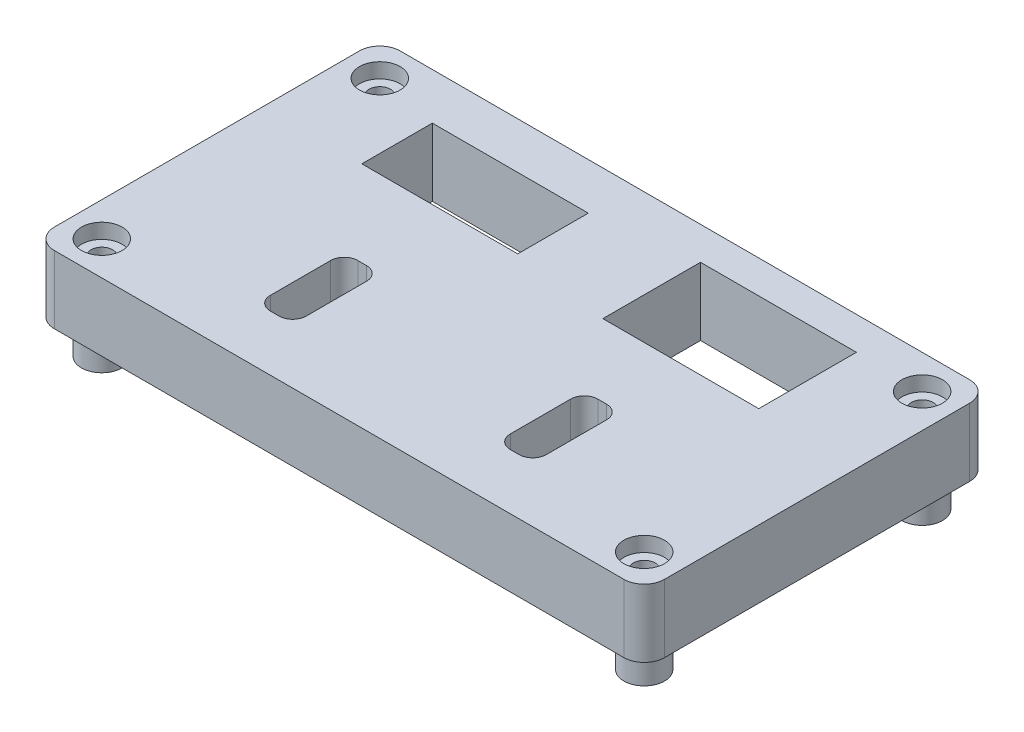
from build123d import *

# Parameters (mm, degrees)
SKETCH_1_W          = 90
SKETCH_1_H          = 51
SKETCH_1_R          = 1.6
SKETCH_1_W_2        = 23
SKETCH_1_H_2        = 10.4
SKETCH_1_H_3        = 14.4
SKETCH_1_W_3        = 5.3
SKETCH_1_H_4        = 12.9
EXTRUDE_1_DEPTH     = 10
FILLET_1_R          = 2
EXTRUDE_START       = 5
SKETCH_2_R          = 3
SKETCH_2_R_2        = 1.6
EXTRUDE_2_DEPTH     = 5
FILLET_2_R          = 3
CUT_EXTRUDE_START   = -2.2
SKETCH_3_R          = 3
CUT_EXTRUDE_1_DEPTH = 2.2


with BuildPart() as part:
    # ｽｹｯﾁ1 → ﾎﾞｽ - 押し出し1 (new body)
    with BuildSketch(Plane(origin=(0, 0, 0), x_dir=(1, 0, 0), z_dir=(0, 1, 0))):
        with Locations((45, 25.5)):
            Rectangle(SKETCH_1_W, SKETCH_1_H)
        with Locations(Location((5, 46, 0), (0, 0, 270))):
            Circle(SKETCH_1_R, mode=Mode.SUBTRACT)
        with Locations(Location((85, 46, 0), (0, 0, 90))):
            Circle(SKETCH_1_R, mode=Mode.SUBTRACT)
        with Locations(Location((85, 5, 0), (0, 0, 270))):
            Circle(SKETCH_1_R, mode=Mode.SUBTRACT)
        with Locations(Location((5, 5, 0), (0, 0, 90))):
            Circle(SKETCH_1_R, mode=Mode.SUBTRACT)
        with Locations((26.1, 38.95)):
            Rectangle(SKETCH_1_W_2, SKETCH_1_H_2, mode=Mode.SUBTRACT)
        with Locations((63.65, 38.95)):
            Rectangle(SKETCH_1_W_2, SKETCH_1_H_3, mode=Mode.SUBTRACT)
        with Locations((27.3, 14.65)):
            Rectangle(SKETCH_1_W_3, SKETCH_1_H_4, mode=Mode.SUBTRACT)
        with Locations((62.7, 14.65)):
            Rectangle(SKETCH_1_W_3, SKETCH_1_H_4, mode=Mode.SUBTRACT)
    extrude(amount=EXTRUDE_1_DEPTH)

    # ﾌｨﾚｯﾄ1
    fillet_1_edges = [part.edges().sort_by_distance(p)[0] for p in [
        (60.05, 5, -21.1),
        (60.05, 5, -8.2),
        (65.35, 5, -8.2),
        (65.35, 5, -21.1),
        (29.95, 5, -21.1),
        (24.65, 5, -21.1),
        (24.65, 5, -8.2),
        (29.95, 5, -8.2),
    ]]
    fillet(fillet_1_edges, radius=FILLET_1_R)

    # ｽｹｯﾁ2 → ﾎﾞｽ - 押し出し2 (add)
    # profile 1 of 4: a face of its own
    with BuildSketch(Plane.XZ.offset(EXTRUDE_START)):
        with Locations(Location((5, -5, 0), (0, 0, 270))):
            Circle(SKETCH_2_R)
        with Locations(Location((5, -5, 0), (0, 0, 270))):
            Circle(SKETCH_2_R_2, mode=Mode.SUBTRACT)
    # profile 2 of 4: a face of its own
    with BuildSketch(Plane.XZ.offset(EXTRUDE_START)):
        with Locations(Location((85, -5, 0), (0, 0, 90))):
            Circle(SKETCH_2_R)
        with Locations(Location((85, -5, 0), (0, 0, 90))):
            Circle(SKETCH_2_R_2, mode=Mode.SUBTRACT)
    # profile 3 of 4: a face of its own
    with BuildSketch(Plane.XZ.offset(EXTRUDE_START)):
        with Locations(Location((85, -46, 0), (0, 0, 270))):
            Circle(SKETCH_2_R)
        with Locations(Location((85, -46, 0), (0, 0, 270))):
            Circle(SKETCH_2_R_2, mode=Mode.SUBTRACT)
    # profile 4 of 4: a face of its own
    with BuildSketch(Plane.XZ.offset(EXTRUDE_START)):
        with Locations(Location((5, -46, 0), (0, 0, 90))):
            Circle(SKETCH_2_R)
        with Locations(Location((5, -46, 0), (0, 0, 90))):
            Circle(SKETCH_2_R_2, mode=Mode.SUBTRACT)
    extrude(amount=-EXTRUDE_2_DEPTH)

    # ﾌｨﾚｯﾄ2
    fillet_2_edges = [part.edges().sort_by_distance(p)[0] for p in [
        (0, 5, -51),
        (90, 5, -51),
        (90, 5, 0),
        (0, 5, 0),
    ]]
    fillet(fillet_2_edges, radius=FILLET_2_R)

    # ｽｹｯﾁ3 → ｶｯﾄ - 押し出し1 (cut)
    with BuildSketch(Plane(origin=(0, 10, 0), x_dir=(1, 0, 0), z_dir=(0, 1, 0)).offset(CUT_EXTRUDE_START)):
        with Locations(Location((5, 46, 0), (0, 0, 270))):
            Circle(SKETCH_3_R)
        with Locations(Location((85, 46, 0), (0, 0, 90))):
            Circle(SKETCH_3_R)
        with Locations(Location((85, 5, 0), (0, 0, 270))):
            Circle(SKETCH_3_R)
        with Locations(Location((5, 5, 0), (0, 0, 90))):
            Circle(SKETCH_3_R)
    extrude(amount=CUT_EXTRUDE_1_DEPTH, mode=Mode.SUBTRACT)


solid = part.part
